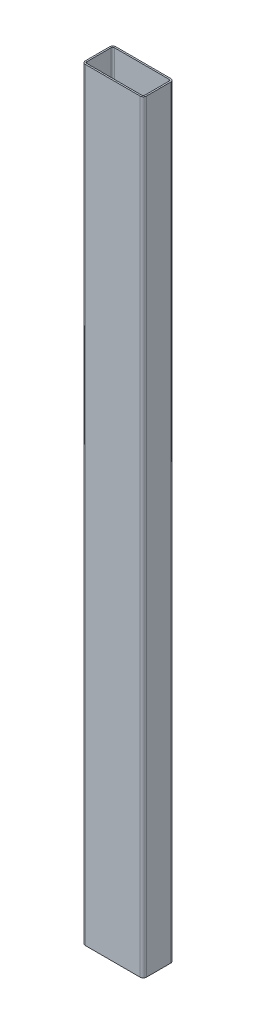
from build123d import *

# Parameters (mm, degrees)
BOSS_EXTRUDE1_DEPTH = 500


with BuildPart() as part:
    # Sketch1 → Boss-Extrude1 (new, symmetric)
    with BuildSketch(Plane(origin=(0, 0, 0), x_dir=(1, 0, 0), z_dir=(0, 1, 0))):
        with BuildLine():
            Line((-36, -20), (36, -20))
            ThreePointArc((36, -20), (38.828427125, -18.828427125), (40, -16))
            Line((40, -16), (40, 16))
            ThreePointArc((40, 16), (38.828427125, 18.828427125), (36, 20))
            Line((36, 20), (-36, 20))
            ThreePointArc((-36, 20), (-38.828427125, 18.828427125), (-40, 16))
            Line((-40, 16), (-40, -16))
            ThreePointArc((-40, -16), (-38.828427125, -18.828427125), (-36, -20))
        make_face()
        with BuildLine():
            Line((-38, -16), (-38, 16))
            ThreePointArc((-38, 16), (-37.414213562, 17.414213562), (-36, 18))
            Line((-36, 18), (36, 18))
            ThreePointArc((36, 18), (37.414213562, 17.414213562), (38, 16))
            Line((38, 16), (38, -16))
            ThreePointArc((38, -16), (37.414213562, -17.414213562), (36, -18))
            Line((36, -18), (-36, -18))
            ThreePointArc((-36, -18), (-37.414213562, -17.414213562), (-38, -16))
        make_face(mode=Mode.SUBTRACT)
    extrude(amount=BOSS_EXTRUDE1_DEPTH, both=True)


solid = part.part
